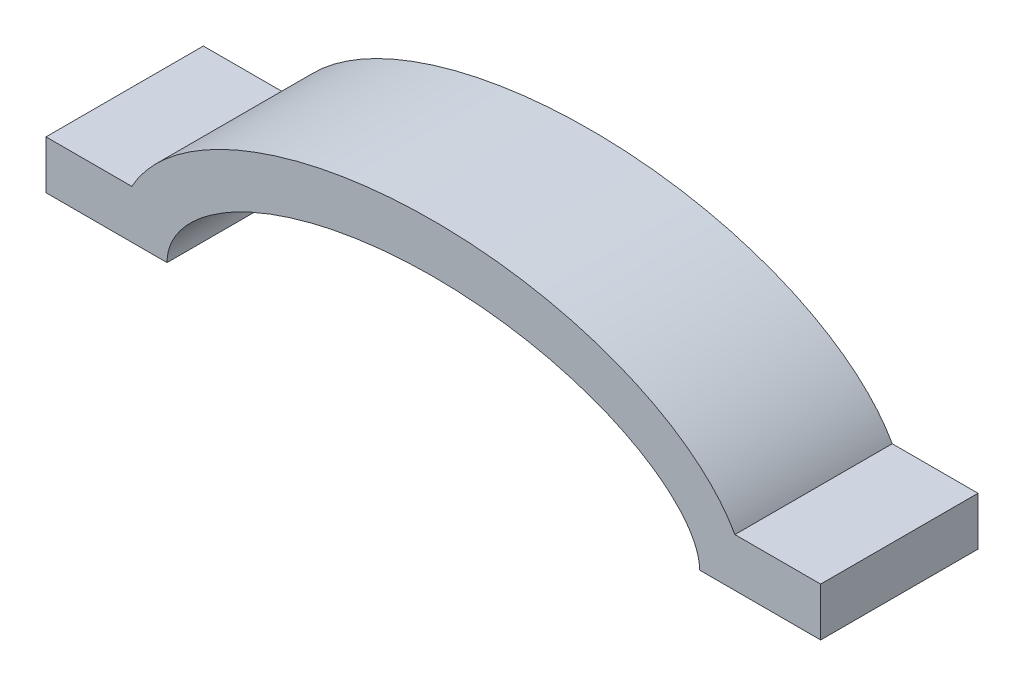
from build123d import *

# Parameters (mm, degrees)
BOSS_EXTRUDE4_DEPTH = 13


with BuildPart() as part:
    # Sketch1 → Boss-Extrude4 (new body)
    with BuildSketch(Plane.XY):
        with BuildLine():
            Line((-22, 0), (-32, 0))
            Line((-32, 0), (-32, 4))
            Line((-32, 4), (-24.916186035, 4))
            add(Edge.make_bspline(
                [(24.916186035, 4), (0, 49), (-24.916186035, 4)],
                knots=[3.431344355, 3.431344355, 3.431344355, 5.993433606, 5.993433606, 5.993433606], degree=2, weights=[1, 0.285714286, 1]))
            Line((24.916186035, 4), (32, 4))
            Line((32, 4), (32, 0))
            Line((32, 0), (22, 0))
            add(Edge.make_bspline(
                [(22, 0), (22, 0.432036642), (21.854886362, 1.296109926), (20.997387843, 2.886644647), (19.258004947, 4.669386797), (15.741252168, 6.998785757), (9.364361038, 9.328152259), (0, 10.335923871), (-9.364361038, 9.328152259), (-15.741252168, 6.998785757), (-19.258004947, 4.669386797), (-20.997387843, 2.886644647), (-21.854886362, 1.296109926), (-22, 0.432036642), (-22, 0)],
                knots=[3.141592654, 3.141592654, 3.141592654, 3.141592654, 3.337942194, 3.534291735, 3.730641276, 3.926990817, 4.319689899, 4.71238898, 5.105088062, 5.497787144, 5.694136685, 5.890486225, 6.086835766, 6.283185307, 6.283185307, 6.283185307, 6.283185307], degree=3))
        make_face()
    extrude(amount=BOSS_EXTRUDE4_DEPTH)


solid = part.part
